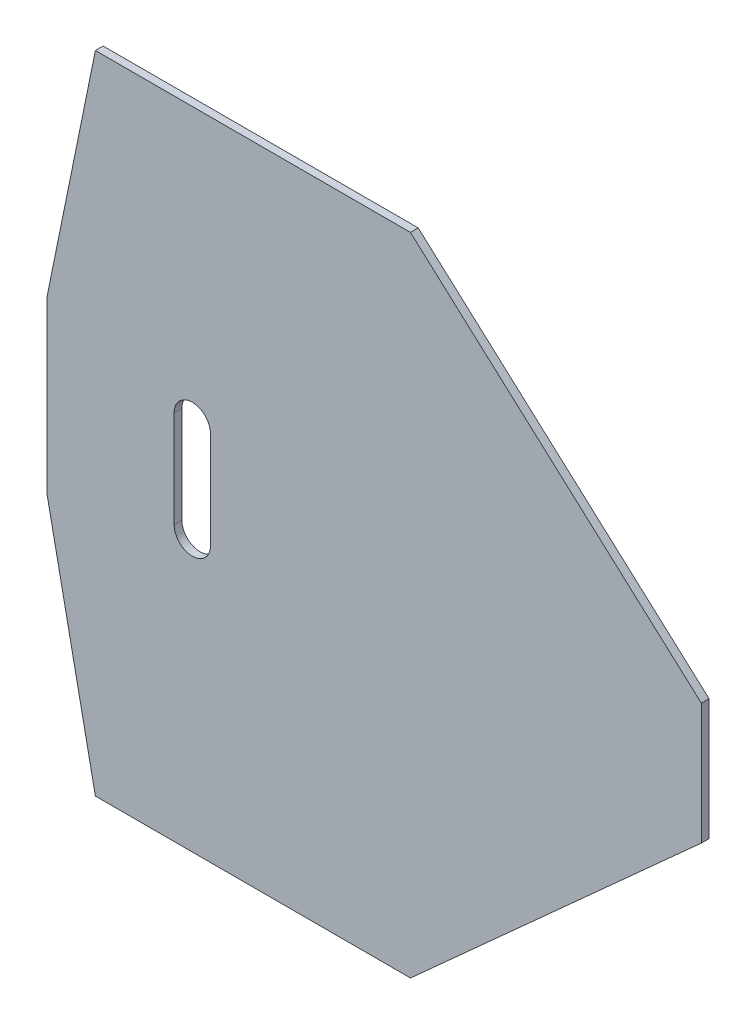
from build123d import *

# Parameters (mm, degrees)
EXTRUDE_1_DEPTH     = 3.2
CUT_EXTRUDE_1_DEPTH = 3.2


with BuildPart() as part:
    # Эскиз1 → Бобышка-Вытянуть1 (new body)
    with BuildSketch(Plane.XY):
        Polygon((70, -53.2), (-60, -53.2), (-80, 45), (-80, 115), (-60, 213.2), (70, 213.2), (190, 105), (190, 55), align=None)
    extrude(amount=EXTRUDE_1_DEPTH)

    # Эскиз2 → Вырез-Вытянуть1 (cut)
    with BuildSketch(Plane.XY.offset(3.2)):
        with BuildLine():
            Line((-27.5, 60), (-27.5, 100))
            ThreePointArc((-27.5, 100), (-20, 107.5), (-12.5, 100))
            Line((-12.5, 100), (-12.5, 60))
            ThreePointArc((-12.5, 60), (-20, 52.5), (-27.5, 60))
        make_face()
    extrude(amount=-CUT_EXTRUDE_1_DEPTH, mode=Mode.SUBTRACT)


solid = part.part
